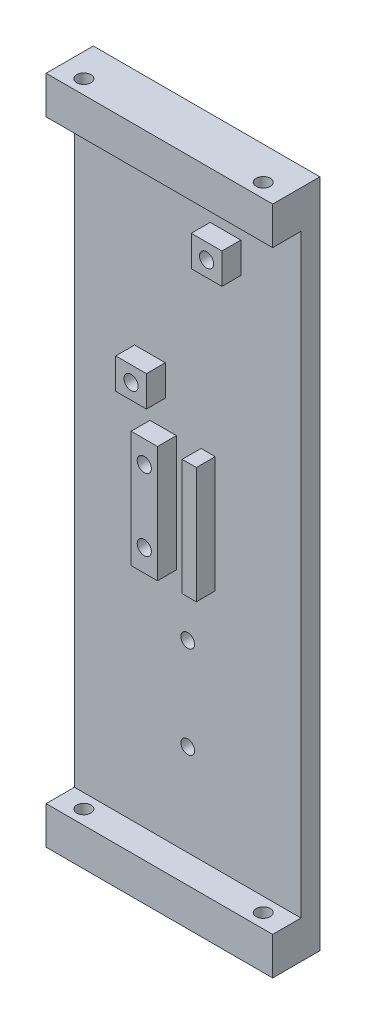
from build123d import *
from build123d.topology import SkipClean

# Parameters (mm, degrees)
SZKIC1_W                        = 48
SZKIC1_H                        = 142
DODANIE_WYCI_GNI_CIE1_DEPTH     = 4
DODANIE_WYCI_GNI_CIE3_DEPTH     = 4
WYTNIJ_WYCI_GNI_CIE1_DEPTH      = 55
WYTNIJ_WYCI_GNI_CIE1_DEPTH_BACK = 10
SZKIC3_R                        = 1.5
SZKIC4_W                        = 3
SZKIC4_H                        = 24.64
DODANIE_WYCI_GNI_CIE4_DEPTH     = 4
SZKIC5_W                        = 48
SZKIC5_H                        = 8
DODANIE_WYCI_GNI_CIE5_DEPTH     = 6
SZKIC6_W                        = 48
SZKIC6_H                        = 8
DODANIE_WYCI_GNI_CIE6_DEPTH     = 6
SZKIC9_R                        = 1.5
WYTNIJ_WYCI_GNI_CIE4_DEPTH      = 10
WYTNIJ_WYCI_GNI_CIE5_START      = -10
SZKIC10_R                       = 1.5
WYTNIJ_WYCI_GNI_CIE5_DEPTH      = 10
SZKIC12_W                       = 6.5
SZKIC12_H                       = 6.5
SZKIC12_R                       = 1.5
DODANIE_WYCI_GNI_CIE7_DEPTH     = 4
SZKIC15_R                       = 1.45
WYTNIJ_WYCI_GNI_CIE6_DEPTH      = 10
WYTNIJ_WYCI_GNI_CIE7_START      = -10
SZKIC16_R                       = 1.5
WYTNIJ_WYCI_GNI_CIE7_DEPTH      = 10
SFAZOWANIE1_SIZE                = 1


with BuildPart() as part:
    # Szkic1 → Dodanie-wyciągnięcie1 (new body)
    with BuildSketch(Plane.XY):
        with Locations((-11.283325816, 0)):
            Rectangle(SZKIC1_W, SZKIC1_H)
    extrude(amount=DODANIE_WYCI_GNI_CIE1_DEPTH)

    # Szkic2 → Dodanie-wyciągnięcie3 (add)
    with BuildSketch(Plane.XY.offset(4)):
        Polygon((-13.683325816, 12.317647524), (-19.283325816, 12.317647524), (-19.283325816, -12.322647524), (-16.483325816, -12.322647524), (-13.683325816, -12.322647524), align=None)
    extrude(amount=DODANIE_WYCI_GNI_CIE3_DEPTH)

    # Szkic3 → Wytnij-wyciągnięcie1 (cut, two sides: drawn at the far end of the back side and taken through both)
    with BuildSketch(Plane.XY.offset(8).offset(-WYTNIJ_WYCI_GNI_CIE1_DEPTH_BACK)):
        with Locations(Location((-16.483325816, 7.6225, 0), (0, 0, 180))):
            Circle(SZKIC3_R)
        with Locations(Location((-16.483325816, -7.6325, 0), (0, 0, 180))):
            Circle(SZKIC3_R)
    extrude(amount=WYTNIJ_WYCI_GNI_CIE1_DEPTH + WYTNIJ_WYCI_GNI_CIE1_DEPTH_BACK, mode=Mode.SUBTRACT)

    # Szkic4 → Dodanie-wyciągnięcie4 (add)
    with BuildSketch(Plane.XY.offset(4)):
        with Locations((-6.963325816, 0.250968311)):
            Rectangle(SZKIC4_W, SZKIC4_H)
    extrude(amount=DODANIE_WYCI_GNI_CIE4_DEPTH)

    # Szkic5 → Dodanie-wyciągnięcie5 (add)
    with BuildSketch(Plane.XY.offset(4)):
        with Locations((-11.283325816, 67)):
            Rectangle(SZKIC5_W, SZKIC5_H)
    extrude(amount=DODANIE_WYCI_GNI_CIE5_DEPTH)

    # Szkic6 → Dodanie-wyciągnięcie6 (add)
    with BuildSketch(Plane.XY.offset(4)):
        with Locations((-11.283325816, -67)):
            Rectangle(SZKIC6_W, SZKIC6_H)
    extrude(amount=DODANIE_WYCI_GNI_CIE6_DEPTH)

    # Szkic9 → Wytnij-wyciągnięcie4 (cut)
    with BuildSketch(Plane.XZ.offset(71)):
        with Locations(Location((-30.283325816, 7, 0), (0, 0, 270))):
            Circle(SZKIC9_R)
        with Locations(Location((7.716674184, 7, 0), (0, 0, 270))):
            Circle(SZKIC9_R)
    extrude(amount=-WYTNIJ_WYCI_GNI_CIE4_DEPTH, mode=Mode.SUBTRACT)

    # Szkic10 → Wytnij-wyciągnięcie5 (cut)
    with BuildSketch(Plane(origin=(0, 71, 0), x_dir=(-1, 0, 0), z_dir=(0, 1, 0)).offset(WYTNIJ_WYCI_GNI_CIE5_START)):
        with Locations(Location((-7.716674184, 7, 0), (0, 0, 270))):
            Circle(SZKIC10_R)
        with Locations(Location((30.283325816, 7, 0), (0, 0, 270))):
            Circle(SZKIC10_R)
    extrude(amount=WYTNIJ_WYCI_GNI_CIE5_DEPTH, mode=Mode.SUBTRACT)

    # Szkic12 → Dodanie-wyciągnięcie7 (add)
    # profile 1 of 2: a face of its own
    with BuildSketch(Plane.XY.offset(4)):
        with Locations((-19.283325816, 21.26353769)):
            Rectangle(SZKIC12_W, SZKIC12_H)
        with Locations((-19.283325816, 21.26353769)):
            Circle(SZKIC12_R, mode=Mode.SUBTRACT)
    # profile 2 of 2: a face of its own
    with BuildSketch(Plane.XY.offset(4)):
        with Locations((-3.283325816, 51.76353769)):
            Rectangle(SZKIC12_W, SZKIC12_H)
        with Locations((-3.283325816, 51.76353769)):
            Circle(SZKIC12_R, mode=Mode.SUBTRACT)
    extrude(amount=DODANIE_WYCI_GNI_CIE7_DEPTH)

    # Szkic15 → Wytnij-wyciągnięcie6 (cut)
    with BuildSketch(Plane.XY.offset(4)):
        with Locations((-11.283325816, -24.067309246)):
            Circle(SZKIC15_R)
        with Locations((-11.283325816, -43.567309246)):
            Circle(SZKIC15_R)
    extrude(amount=-WYTNIJ_WYCI_GNI_CIE6_DEPTH, mode=Mode.SUBTRACT)

    # Szkic16 → Wytnij-wyciągnięcie7 (cut)
    with SkipClean():  # the faces are left unmerged after this step: merging them gives an invalid solid
        with BuildSketch(Plane.XY.offset(8).offset(WYTNIJ_WYCI_GNI_CIE7_START)):
            with Locations(Location((-3.283325816, 51.76353769, 0), (0, 0, 180))):
                Circle(SZKIC16_R)
            with Locations(Location((-19.283325816, 21.26353769, 0), (0, 0, 180))):
                Circle(SZKIC16_R)
        extrude(amount=WYTNIJ_WYCI_GNI_CIE7_DEPTH, mode=Mode.SUBTRACT)

    # Sfazowanie1
    sfazowanie1_edges = [part.edges().sort_by_distance(p)[0] for p in [
        (-1.783325816, 51.76353769, 0),
        (-17.783325816, 21.26353769, 0),
        (-14.983325816, -7.6325, 0),
        (-14.983325816, 7.6225, 0),
    ]]
    chamfer(sfazowanie1_edges, length=SFAZOWANIE1_SIZE)


solid = part.part
